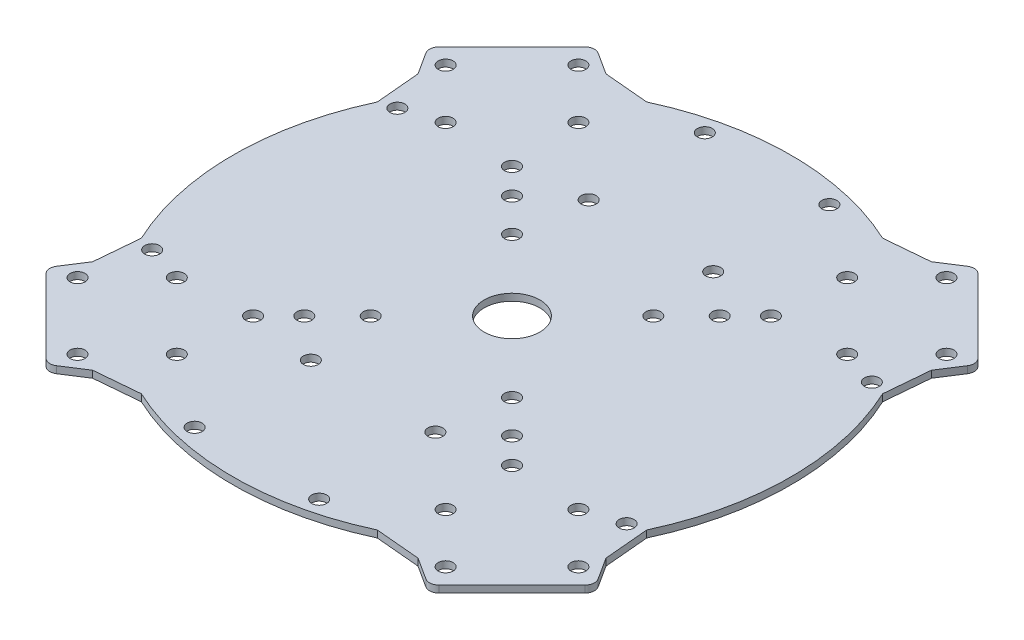
from build123d import *

# Parameters (mm, degrees)
SKETCH_1_R      = 1.6
SKETCH_1_R_2    = 6
EXTRUDE_2_DEPTH = 1.5


with BuildPart() as part:
    # 草图1 → 凸台-拉伸2 (new body)
    with BuildSketch(Plane(origin=(0, 0, 0), x_dir=(1, 0, 0), z_dir=(0, 1, 0))):
        with BuildLine():
            Line((58.010697546, -42.257044027), (42.257044027, -58.010697546))
            ThreePointArc((42.257044027, -58.010697546), (41.057354584, -58.58494555), (39.762791017, -58.279788707))
            Line((39.762791017, -58.279788707), (35.001785669, -55.225039611))
            Line((35.001785669, -55.225039611), (25.377547624, -54.368925652))
            ThreePointArc((25.377547624, -54.368925652), (0, -60), (-25.377547624, -54.368925652))
            Line((-25.377547624, -54.368925652), (-35.001785669, -55.225039611))
            Line((-35.001785669, -55.225039611), (-39.762791017, -58.279788707))
            ThreePointArc((-39.762791017, -58.279788707), (-41.057354584, -58.58494555), (-42.257044027, -58.010697546))
            Line((-42.257044027, -58.010697546), (-58.010697546, -42.257044027))
            ThreePointArc((-58.010697546, -42.257044027), (-58.58494555, -41.057354584), (-58.279788707, -39.762791017))
            Line((-58.279788707, -39.762791017), (-55.225039611, -35.001785669))
            Line((-55.225039611, -35.001785669), (-54.368925652, -25.377547624))
            ThreePointArc((-54.368925652, -25.377547624), (-60, 0), (-54.368925652, 25.377547624))
            Line((-54.368925652, 25.377547624), (-55.225039611, 35.001785669))
            Line((-55.225039611, 35.001785669), (-58.279788707, 39.762791017))
            ThreePointArc((-58.279788707, 39.762791017), (-58.58494555, 41.057354584), (-58.010697546, 42.257044027))
            Line((-58.010697546, 42.257044027), (-42.257044027, 58.010697546))
            ThreePointArc((-42.257044027, 58.010697546), (-41.057354584, 58.58494555), (-39.762791017, 58.279788707))
            Line((-39.762791017, 58.279788707), (-35.001785669, 55.225039611))
            Line((-35.001785669, 55.225039611), (-25.377547624, 54.368925652))
            ThreePointArc((-25.377547624, 54.368925652), (0, 60), (25.377547624, 54.368925652))
            Line((25.377547624, 54.368925652), (35.001785669, 55.225039611))
            Line((35.001785669, 55.225039611), (39.762791017, 58.279788707))
            ThreePointArc((39.762791017, 58.279788707), (41.057354584, 58.58494555), (42.257044027, 58.010697546))
            Line((42.257044027, 58.010697546), (58.010697546, 42.257044027))
            ThreePointArc((58.010697546, 42.257044027), (58.58494555, 41.057354584), (58.279788707, 39.762791017))
            Line((58.279788707, 39.762791017), (55.225039611, 35.001785669))
            Line((55.225039611, 35.001785669), (54.368925652, 25.377547624))
            ThreePointArc((54.368925652, 25.377547624), (60, 0), (54.368925652, -25.377547624))
            Line((54.368925652, -25.377547624), (55.225039611, -35.001785669))
            Line((55.225039611, -35.001785669), (58.279788707, -39.762791017))
            ThreePointArc((58.279788707, -39.762791017), (58.58494555, -41.057354584), (58.010697546, -42.257044027))
        make_face()
        with Locations(Location((39.597979746, 53.881536726, 0), (0, 0, 270))):
            Circle(SKETCH_1_R, mode=Mode.SUBTRACT)
        with Locations(Location((53.881536726, 39.597979746, 0), (0, 0, 270))):
            Circle(SKETCH_1_R, mode=Mode.SUBTRACT)
        with Locations(Location((28.920667351, 43.20422433, 0), (0, 0, 270))):
            Circle(SKETCH_1_R, mode=Mode.SUBTRACT)
        with Locations(Location((43.20422433, 28.920667351, 0), (0, 0, 270))):
            Circle(SKETCH_1_R, mode=Mode.SUBTRACT)
        with Locations(Location((27.860007179, 27.860007179, 0), (0, 0, 270))):
            Circle(SKETCH_1_R, mode=Mode.SUBTRACT)
        with Locations(Location((22.344574285, 22.344574285, 0), (0, 0, 270))):
            Circle(SKETCH_1_R, mode=Mode.SUBTRACT)
        with Locations(Location((15.202795796, 15.202795796, 0), (0, 0, 270))):
            Circle(SKETCH_1_R, mode=Mode.SUBTRACT)
        with Locations(Location((13.4, 54.887976826, 0), (0, 0, 270))):
            Circle(SKETCH_1_R, mode=Mode.SUBTRACT)
        with Locations(Location((13.4, 29.887976826, 0), (0, 0, 270))):
            Circle(SKETCH_1_R, mode=Mode.SUBTRACT)
        with Locations(Location((-13.4, 29.887976826, 0), (0, 0, 270))):
            Circle(SKETCH_1_R, mode=Mode.SUBTRACT)
        with Locations(Location((-13.4, 54.887976826, 0), (0, 0, 270))):
            Circle(SKETCH_1_R, mode=Mode.SUBTRACT)
        with Locations(Location((51.04496003, 26.38323251, 0), (0, 0, 270))):
            Circle(SKETCH_1_R, mode=Mode.SUBTRACT)
        with Locations(Location((-15.202795796, 15.202795796, 0), (0, 0, 270))):
            Circle(SKETCH_1_R, mode=Mode.SUBTRACT)
        with Locations(Location((-22.344574285, 22.344574285, 0), (0, 0, 270))):
            Circle(SKETCH_1_R, mode=Mode.SUBTRACT)
        with Locations(Location((-27.860007179, 27.860007179, 0), (0, 0, 270))):
            Circle(SKETCH_1_R, mode=Mode.SUBTRACT)
        with Locations(Location((-43.20422433, 28.920667351, 0), (0, 0, 270))):
            Circle(SKETCH_1_R, mode=Mode.SUBTRACT)
        with Locations(Location((-51.04496003, 26.38323251, 0), (0, 0, 270))):
            Circle(SKETCH_1_R, mode=Mode.SUBTRACT)
        with Locations(Location((-28.920667351, 43.20422433, 0), (0, 0, 270))):
            Circle(SKETCH_1_R, mode=Mode.SUBTRACT)
        with Locations(Location((-53.881536726, 39.597979746, 0), (0, 0, 270))):
            Circle(SKETCH_1_R, mode=Mode.SUBTRACT)
        with Locations(Location((-39.597979746, 53.881536726, 0), (0, 0, 270))):
            Circle(SKETCH_1_R, mode=Mode.SUBTRACT)
        with Locations(Location((43.20422433, -28.920667351, 0), (0, 0, 270))):
            Circle(SKETCH_1_R, mode=Mode.SUBTRACT)
        with Locations(Location((51.04496003, -26.38323251, 0), (0, 0, 270))):
            Circle(SKETCH_1_R, mode=Mode.SUBTRACT)
        with Locations(Location((53.881536726, -39.597979746, 0), (0, 0, 270))):
            Circle(SKETCH_1_R, mode=Mode.SUBTRACT)
        with Locations(Location((39.597979746, -53.881536726, 0), (0, 0, 270))):
            Circle(SKETCH_1_R, mode=Mode.SUBTRACT)
        with Locations(Location((28.920667351, -43.20422433, 0), (0, 0, 270))):
            Circle(SKETCH_1_R, mode=Mode.SUBTRACT)
        with Locations(Location((27.860007179, -27.860007179, 0), (0, 0, 270))):
            Circle(SKETCH_1_R, mode=Mode.SUBTRACT)
        with Locations(Location((22.344574285, -22.344574285, 0), (0, 0, 270))):
            Circle(SKETCH_1_R, mode=Mode.SUBTRACT)
        with Locations(Location((15.202795796, -15.202795796, 0), (0, 0, 270))):
            Circle(SKETCH_1_R, mode=Mode.SUBTRACT)
        with Locations(Location((13.4, -29.887976826, 0), (0, 0, 270))):
            Circle(SKETCH_1_R, mode=Mode.SUBTRACT)
        with Locations(Location((13.4, -54.887976826, 0), (0, 0, 270))):
            Circle(SKETCH_1_R, mode=Mode.SUBTRACT)
        with Locations(Location((-13.4, -29.887976826, 0), (0, 0, 270))):
            Circle(SKETCH_1_R, mode=Mode.SUBTRACT)
        with Locations(Location((-15.202795796, -15.202795796, 0), (0, 0, 270))):
            Circle(SKETCH_1_R, mode=Mode.SUBTRACT)
        with Locations(Location((-22.344574285, -22.344574285, 0), (0, 0, 270))):
            Circle(SKETCH_1_R, mode=Mode.SUBTRACT)
        with Locations(Location((-27.860007179, -27.860007179, 0), (0, 0, 270))):
            Circle(SKETCH_1_R, mode=Mode.SUBTRACT)
        with Locations(Location((-13.4, -54.887976826, 0), (0, 0, 270))):
            Circle(SKETCH_1_R, mode=Mode.SUBTRACT)
        with Locations(Location((-28.920667351, -43.20422433, 0), (0, 0, 270))):
            Circle(SKETCH_1_R, mode=Mode.SUBTRACT)
        with Locations(Location((-43.20422433, -28.920667351, 0), (0, 0, 270))):
            Circle(SKETCH_1_R, mode=Mode.SUBTRACT)
        with Locations(Location((-51.04496003, -26.38323251, 0), (0, 0, 270))):
            Circle(SKETCH_1_R, mode=Mode.SUBTRACT)
        with Locations(Location((-39.597979746, -53.881536726, 0), (0, 0, 270))):
            Circle(SKETCH_1_R, mode=Mode.SUBTRACT)
        with Locations(Location((-53.881536726, -39.597979746, 0), (0, 0, 270))):
            Circle(SKETCH_1_R, mode=Mode.SUBTRACT)
        with Locations(Location((0, 0, 0), (0, 0, 270))):
            Circle(SKETCH_1_R_2, mode=Mode.SUBTRACT)
    extrude(amount=EXTRUDE_2_DEPTH)


solid = part.part
